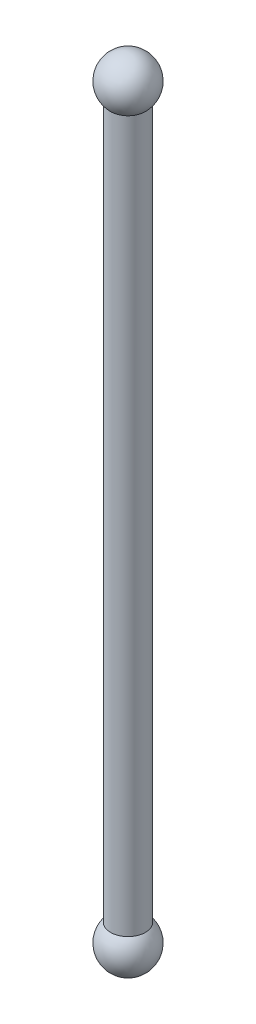
from build123d import *


with BuildPart() as part:
    # Sketch1 → Revolve1 (revolve)
    with BuildSketch(Plane.XY, mode=Mode.PRIVATE) as revolve1_sk:
        with BuildLine():
            Line((0, 310), (0, 300))
            Line((0, 300), (7, 300))
            Line((7, 300), (7, 292.858571571))
            ThreePointArc((7, 292.858571571), (9.257815193, 303.780589618), (0, 310))
        make_face()
        with BuildLine():
            Line((7, 300), (0, 300))
            Line((0, 300), (0, 290))
            ThreePointArc((0, 290), (3.780589618, 290.742184807), (7, 292.858571571))
            Line((7, 292.858571571), (7, 300))
        make_face()
        with BuildLine():
            ThreePointArc((7, 292.858571571), (3.780589618, 290.742184807), (0, 290))
            Line((0, 290), (0, 10))
            ThreePointArc((0, 10), (3.780589618, 9.257815193), (7, 7.141428429))
            Line((7, 7.141428429), (7, 292.858571571))
        make_face()
        with BuildLine():
            ThreePointArc((7, 7.141428429), (3.780589618, 9.257815193), (0, 10))
            Line((0, 10), (0, 0))
            Line((0, 0), (7, 0))
            Line((7, 0), (7, 7.141428429))
        make_face()
        with BuildLine():
            ThreePointArc((0, -10), (9.257815193, -3.780589618), (7, 7.141428429))
            Line((7, 7.141428429), (7, 0))
            Line((7, 0), (0, 0))
            Line((0, 0), (0, -10))
        make_face()
    revolve(revolve1_sk.sketch.rotate(Axis((0, 0, 0), (0, 1, 0)), 90), axis=Axis((0, 0, 0), (0, 1, 0)))


solid = part.part
